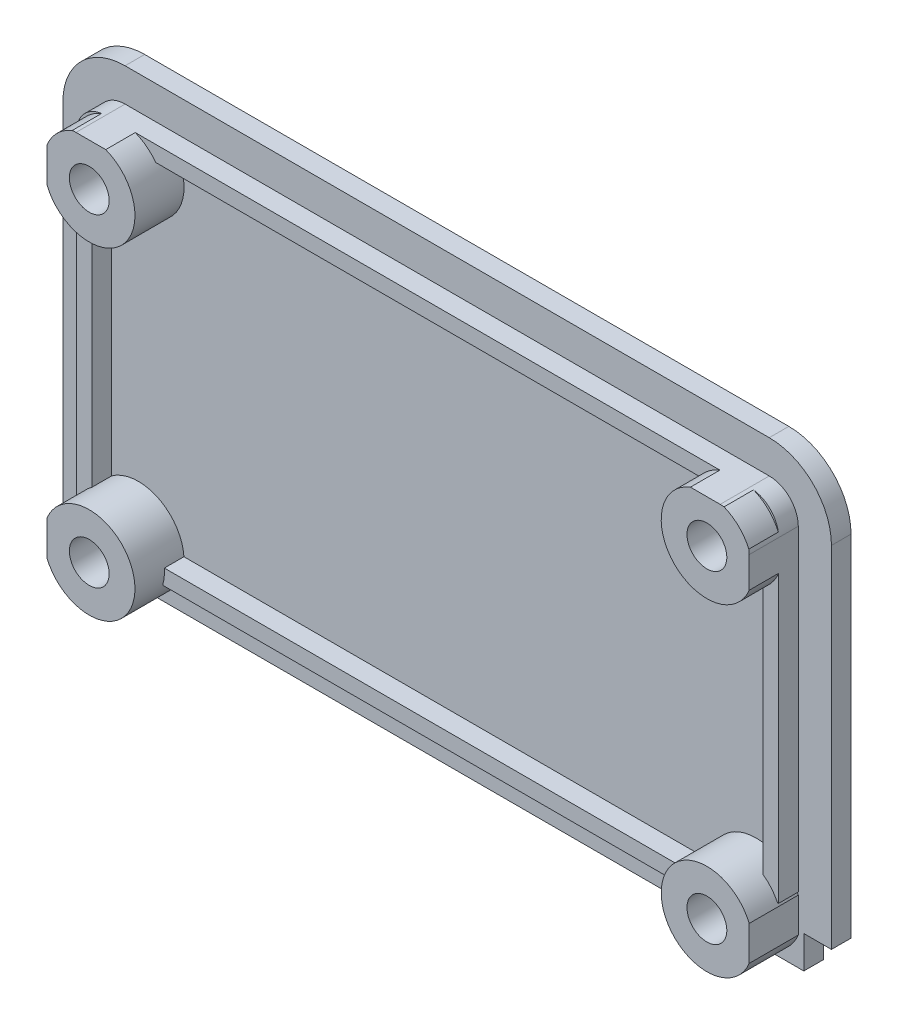
from build123d import *

# Parameters (mm, degrees)
EXTRUDE1_DEPTH                                = 1.2
EXTRUDE_THIN1_DEPTH                           = 1.2
SKETCH9_R                                     = 2.7989
EXTRUDE3_DEPTH                                = 3.008
SKETCH11_OUTSIDE_W                            = 59.99
SKETCH11_OUTSIDE_H                            = 40.146
CUT_EXTRUDE2_DEPTH                            = 28.831479731
CSK_FOR_2_FLAT_HEAD_MACHINE_SCREW1_AT_2_COUNT = 2
CSK_FOR_2_FLAT_HEAD_MACHINE_SCREW1_AT_2_PITCH = 19.795
CSK_FOR_2_FLAT_HEAD_MACHINE_SCREW1_AT_3_COUNT = 2
CSK_FOR_2_FLAT_HEAD_MACHINE_SCREW1_AT_3_PITCH = 42.700459599
CSK_FOR_2_FLAT_HEAD_MACHINE_SCREW1_AT_4_COUNT = 2
CSK_FOR_2_FLAT_HEAD_MACHINE_SCREW1_AT_4_PITCH = 37.835


with BuildPart() as part:
    # Sketch2 → Extrude1 (new body)
    with BuildSketch(Plane.XY):
        with BuildLine():
            Line((22.1, -10.7046), (21.846, -10.7046))
            Line((21.846, -10.7046), (21.846, -12.6964))
            Line((21.846, -12.6964), (-21.846, -12.6964))
            Line((-21.846, -12.6964), (-21.846, -10.7046))
            Line((-21.846, -10.7046), (-22.1, -10.7046))
            Line((-22.1, -10.7046), (-23.54, -10.7046))
            Line((-23.54, -10.7046), (-23.54, 10.73))
            ThreePointArc((-23.54, 10.73), (-22.424076836, 13.424076836), (-19.73, 14.54))
            Line((-19.73, 14.54), (19.73, 14.54))
            ThreePointArc((19.73, 14.54), (22.424076836, 13.424076836), (23.54, 10.73))
            Line((23.54, 10.73), (23.54, -10.7046))
            Line((23.54, -10.7046), (22.1, -10.7046))
        make_face()
    extrude(amount=-EXTRUDE1_DEPTH)

    # Sketch3 → Extrude-Thin1 (add)
    with BuildSketch(Plane.XY):
        with BuildLine():
            Line((-19.814, -8.6726), (-19.814, -10.6644))
            Line((-19.814, -10.6644), (19.814, -10.6644))
            Line((19.814, -10.6644), (19.814, -8.6726))
            Line((19.814, -8.6726), (21.508, -8.6726))
            Line((21.508, -8.6726), (21.508, 10.73))
            ThreePointArc((21.508, 10.73), (20.987235857, 11.987235857), (19.73, 12.508))
            Line((19.73, 12.508), (-19.73, 12.508))
            ThreePointArc((-19.73, 12.508), (-20.987235857, 11.987235857), (-21.508, 10.73))
            Line((-21.508, 10.73), (-21.508, -8.6726))
            Line((-21.508, -8.6726), (-20.548, -8.6726))
            Line((-20.548, -8.6726), (-20.548, 10.73))
            ThreePointArc((-20.548, 10.73), (-20.308413347, 11.308413347), (-19.73, 11.548))
            Line((-19.73, 11.548), (19.73, 11.548))
            ThreePointArc((19.73, 11.548), (20.308413347, 11.308413347), (20.548, 10.73))
            Line((20.548, 10.73), (20.548, -7.7126))
            Line((20.548, -7.7126), (18.854, -7.7126))
            Line((18.854, -7.7126), (18.854, -9.7044))
            Line((18.854, -9.7044), (-18.854, -9.7044))
            Line((-18.854, -9.7044), (-18.854, -8.6726))
            Line((-18.854, -8.6726), (-19.814, -8.6726))
        make_face()
    extrude(amount=EXTRUDE_THIN1_DEPTH)

    # Sketch9 → Extrude3 (add)
    with BuildSketch(Plane.XY):
        with Locations(Location((18.9175, -9.8975, 0), (0, 0, 176.043941969))):
            Circle(SKETCH9_R)
        with Locations(Location((-18.9175, -9.8975, 0), (0, 0, 154.046840703))):
            Circle(SKETCH9_R)
        with Locations(Location((-18.9175, 9.8975, 0), (0, 0, 202.249746806))):
            Circle(SKETCH9_R)
        with Locations(Location((18.9175, 9.8975, 0), (0, 0, 143.864565))):
            Circle(SKETCH9_R)
    extrude(amount=EXTRUDE3_DEPTH)

    # Sketch11 outside → Cut-Extrude2 (cut, through all)
    with BuildSketch(Plane.XY):
        with Locations((0, 0.922)):
            Rectangle(SKETCH11_OUTSIDE_W, SKETCH11_OUTSIDE_H)
        with BuildLine():
            Line((-21.508, 10.73), (-21.508, -12.6964))
            Line((-21.508, -12.6964), (21.508, -12.6964))
            Line((21.508, -12.6964), (21.508, 10.73))
            ThreePointArc((21.508, 10.73), (20.987235857, 11.987235857), (19.73, 12.508))
            Line((19.73, 12.508), (-19.73, 12.508))
            ThreePointArc((-19.73, 12.508), (-20.987235857, 11.987235857), (-21.508, 10.73))
        make_face(mode=Mode.SUBTRACT)
    extrude(amount=CUT_EXTRUDE2_DEPTH, mode=Mode.SUBTRACT)

    # Sketch7 → CSK for #2 Flat Head Machine Screw1 (revolve, cut)
    with BuildSketch(Plane(origin=(18.9175, 9.8975, -1.2), x_dir=(0, 1, 0), z_dir=(1, 0, 0))):
        Polygon((0, 0), (0, 4.208), (1.2192, 4.208), (1.2192, 1.364335587), (2.1844, 0.254), (2.1844, 0), align=None)
    csk_for_2_flat_head_machine_screw1 = revolve(axis=Axis((18.9175, 9.8975, -7.55), (0, 0, 1)), mode=Mode.SUBTRACT)

    # CSK for #2 Flat Head Machine Screw1 at 2: CSK for #2 Flat Head Machine Screw1 ×2
    with Locations(*[(0, -i * CSK_FOR_2_FLAT_HEAD_MACHINE_SCREW1_AT_2_PITCH, 0) for i in range(1, CSK_FOR_2_FLAT_HEAD_MACHINE_SCREW1_AT_2_COUNT)]):
        add(csk_for_2_flat_head_machine_screw1, mode=Mode.SUBTRACT)

    # CSK for #2 Flat Head Machine Screw1 at 3: CSK for #2 Flat Head Machine Screw1 ×2
    with Locations(*[Vector(-0.8860560367488772, -0.46357814847215617, 0) * (i * CSK_FOR_2_FLAT_HEAD_MACHINE_SCREW1_AT_3_PITCH) for i in range(1, CSK_FOR_2_FLAT_HEAD_MACHINE_SCREW1_AT_3_COUNT)]):
        add(csk_for_2_flat_head_machine_screw1, mode=Mode.SUBTRACT)

    # CSK for #2 Flat Head Machine Screw1 at 4: CSK for #2 Flat Head Machine Screw1 ×2
    with Locations(*[(-i * CSK_FOR_2_FLAT_HEAD_MACHINE_SCREW1_AT_4_PITCH, 0, 0) for i in range(1, CSK_FOR_2_FLAT_HEAD_MACHINE_SCREW1_AT_4_COUNT)]):
        add(csk_for_2_flat_head_machine_screw1, mode=Mode.SUBTRACT)


solid = part.part
